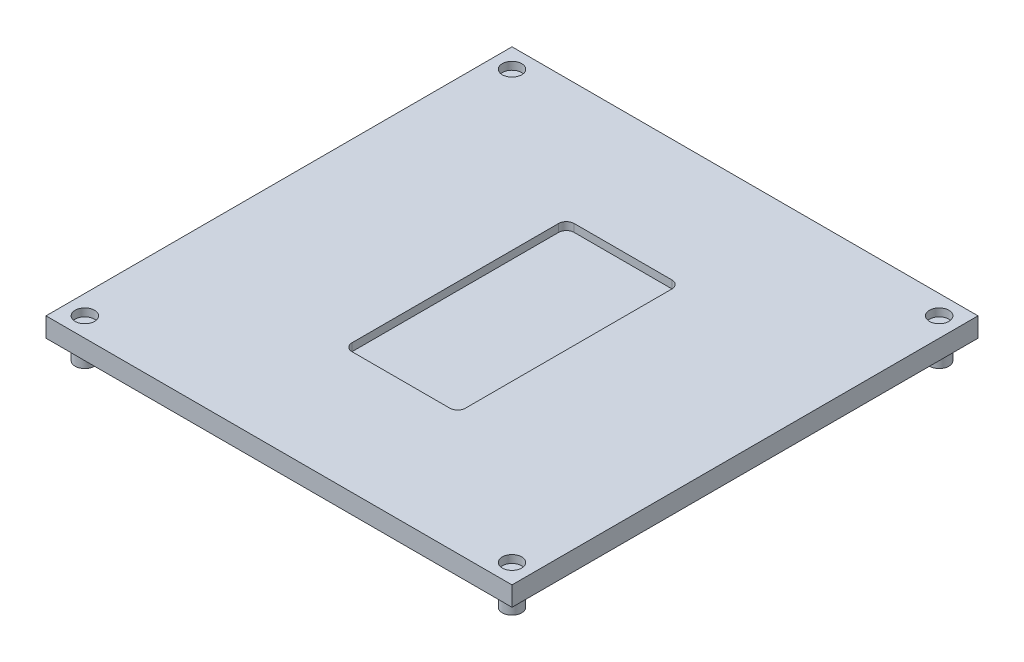
from build123d import *

# Parameters (mm, degrees)
SKETCH1_W           = 152.4
SKETCH1_H           = 152.4
BOSS_EXTRUDE1_DEPTH = 6.35
BOSS_EXTRUDE2_DEPTH = 6.35
SKETCH3_R           = 3.175
CUT_EXTRUDE1_DEPTH  = 2.54
SKETCH4_W           = 37.084
SKETCH4_H           = 72.644
CUT_EXTRUDE2_DEPTH  = 2.54
FILLET1_R           = 2.54
FILLET2_R           = 2.54
FILLET3_R           = 2.54
FILLET4_R           = 2.54


with BuildPart() as part:
    # Sketch1 → Boss-Extrude1 (new body)
    with BuildSketch(Plane(origin=(0, 0, 0), x_dir=(1, 0, 0), z_dir=(0, 1, 0))):
        with Locations((1.284269663, 24.829213483)):
            Rectangle(SKETCH1_W, SKETCH1_H)
    extrude(amount=BOSS_EXTRUDE1_DEPTH)

    # Sketch2 → Boss-Extrude2 (add)
    with BuildSketch(Plane(origin=(0, 0, 0), x_dir=(-1, 0, 0), z_dir=(0, -1, 0))):
        with BuildLine():
            ThreePointArc((-71.134269663, 97.854213483), (-74.309269663, 94.679213483), (-71.134269663, 91.504213483))
            Line((-71.134269663, 91.504213483), (-71.134269663, 97.854213483))
        make_face()
        with BuildLine():
            Line((-71.134269663, 97.854213483), (-71.134269663, 91.504213483))
            ThreePointArc((-71.134269663, 91.504213483), (-68.889205633, 92.434149453), (-67.959269663, 94.679213483))
            ThreePointArc((-67.959269663, 94.679213483), (-68.889205633, 96.924277513), (-71.134269663, 97.854213483))
        make_face()
        with BuildLine():
            ThreePointArc((68.565730337, 97.854213483), (65.390730337, 94.679213483), (68.565730337, 91.504213483))
            Line((68.565730337, 91.504213483), (68.565730337, 97.854213483))
        make_face()
        with BuildLine():
            Line((68.565730337, 97.854213483), (68.565730337, 91.504213483))
            ThreePointArc((68.565730337, 91.504213483), (70.810794367, 92.434149453), (71.740730337, 94.679213483))
            ThreePointArc((71.740730337, 94.679213483), (70.810794367, 96.924277513), (68.565730337, 97.854213483))
        make_face()
        with BuildLine():
            ThreePointArc((68.565730337, -41.845786517), (65.390730337, -45.020786517), (68.565730337, -48.195786517))
            Line((68.565730337, -48.195786517), (68.565730337, -41.845786517))
        make_face()
        with BuildLine():
            Line((68.565730337, -41.845786517), (68.565730337, -48.195786517))
            ThreePointArc((68.565730337, -48.195786517), (70.810794367, -47.265850547), (71.740730337, -45.020786517))
            ThreePointArc((71.740730337, -45.020786517), (70.810794367, -42.775722487), (68.565730337, -41.845786517))
        make_face()
        with BuildLine():
            ThreePointArc((-71.134269663, -41.845786517), (-74.309269663, -45.020786517), (-71.134269663, -48.195786517))
            Line((-71.134269663, -48.195786517), (-71.134269663, -41.845786517))
        make_face()
        with BuildLine():
            Line((-71.134269663, -41.845786517), (-71.134269663, -48.195786517))
            ThreePointArc((-71.134269663, -48.195786517), (-68.889205633, -47.265850547), (-67.959269663, -45.020786517))
            ThreePointArc((-67.959269663, -45.020786517), (-68.889205633, -42.775722487), (-71.134269663, -41.845786517))
        make_face()
    extrude(amount=BOSS_EXTRUDE2_DEPTH)

    # Sketch3 → Cut-Extrude1 (cut)
    with BuildSketch(Plane(origin=(0, 6.35, 0), x_dir=(1, 0, 0), z_dir=(0, 1, 0))):
        with Locations(Location((-68.565730337, 94.679213483, 0), (0, 0, 90))):
            Circle(SKETCH3_R)
        with Locations(Location((71.134269663, 94.679213483, 0), (0, 0, 90))):
            Circle(SKETCH3_R)
        with Locations(Location((-68.565730337, -45.020786517, 0), (0, 0, 90))):
            Circle(SKETCH3_R)
        with Locations(Location((71.134269663, -45.020786517, 0), (0, 0, 90))):
            Circle(SKETCH3_R)
    extrude(amount=-CUT_EXTRUDE1_DEPTH, mode=Mode.SUBTRACT)

    # Sketch4 → Cut-Extrude2 (cut)
    with BuildSketch(Plane(origin=(0, 6.35, 0), x_dir=(1, 0, 0), z_dir=(0, 1, 0))):
        with Locations((1.284269663, 24.829213483)):
            Rectangle(SKETCH4_W, SKETCH4_H)
    extrude(amount=-CUT_EXTRUDE2_DEPTH, mode=Mode.SUBTRACT)

    # Fillet1
    fillet1_edges = [part.edges().sort_by_distance(p)[0] for p in [
        (-17.257730337, 5.08, -61.151213483),
    ]]
    fillet(fillet1_edges, radius=FILLET1_R)

    # Fillet2
    fillet2_edges = [part.edges().sort_by_distance(p)[0] for p in [
        (19.826269663, 5.08, -61.151213483),
    ]]
    fillet(fillet2_edges, radius=FILLET2_R)

    # Fillet3
    fillet3_edges = [part.edges().sort_by_distance(p)[0] for p in [
        (-17.257730337, 5.08, 11.492786517),
    ]]
    fillet(fillet3_edges, radius=FILLET3_R)

    # Fillet4
    fillet4_edges = [part.edges().sort_by_distance(p)[0] for p in [
        (19.826269663, 5.08, 11.492786517),
    ]]
    fillet(fillet4_edges, radius=FILLET4_R)


solid = part.part
